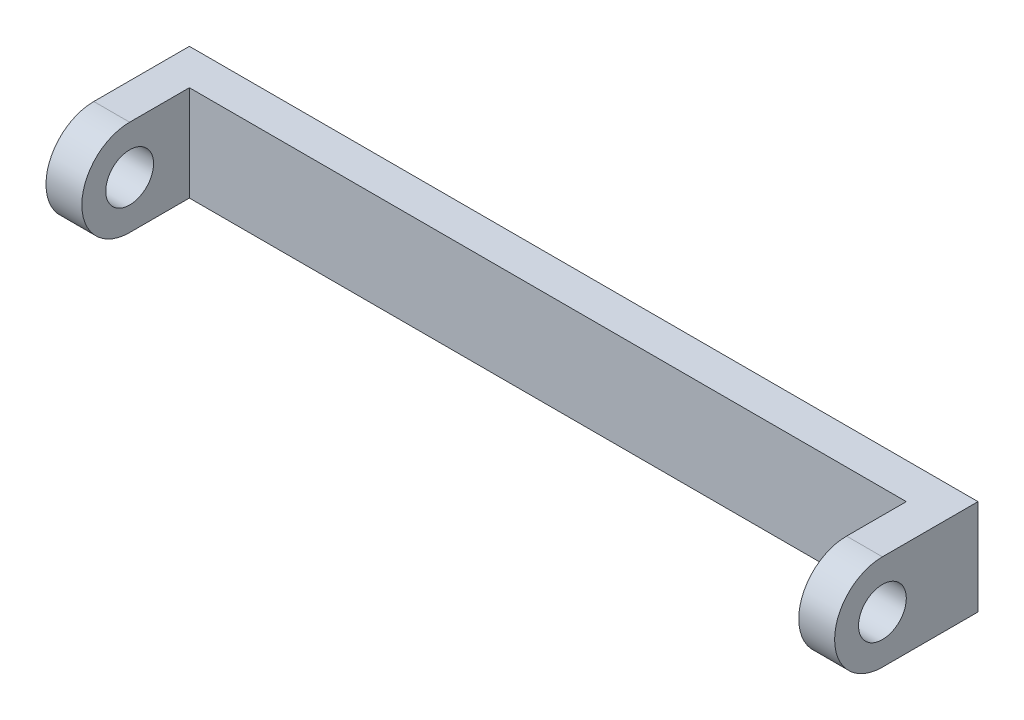
from build123d import *

# Parameters (mm, degrees)
SKETCH1_W                   = 3
SKETCH1_H                   = 8
SKETCH1_W_2                 = 30
BOSS_EXTRUDE3_DEPTH         = 3
SKETCH6_W                   = 3
SKETCH6_H                   = 8
BOSS_EXTRUDE5_DEPTH         = 9
FILLET3_RADIUS              = 4
FILLET3_LENGTH              = 3
SKETCH7_R                   = 2
CUT_EXTRUDE1_DEPTH          = 33.748571352
FILLET3_OF_MIRROR1_2_RADIUS = 4
FILLET3_OF_MIRROR1_2_LENGTH = 3


with BuildPart() as part:
    # Sketch1 → Boss-Extrude3 (new body)
    with BuildSketch(Plane.XY):
        with Locations((-35.895657312, 1.33562795)):
            Rectangle(SKETCH1_W, SKETCH1_H)
        with Locations((-19.395657312, 1.33562795)):
            Rectangle(SKETCH1_W_2, SKETCH1_H)
    boss_extrude3 = extrude(amount=BOSS_EXTRUDE3_DEPTH)

    # Sketch6 → Boss-Extrude5 (add)
    with BuildSketch(Plane.XY.offset(3)):
        with Locations((-35.895657312, 1.33562795)):
            Rectangle(SKETCH6_W, SKETCH6_H)
    boss_extrude5 = extrude(amount=BOSS_EXTRUDE5_DEPTH)

    # Fillet3: full round fillet: the end face becomes a half cylinder, R = half its width
    fillet3_face = Plane((-35.895657312, 1.33562795, 12), x_dir=(-1, 0, 0), z_dir=(0, 0, 1))  # on the end face: x along it, z out of the body
    fillet3_slab = fillet3_face.offset(-FILLET3_RADIUS / 2) * Box(FILLET3_LENGTH, 2 * FILLET3_RADIUS, FILLET3_RADIUS, mode=Mode.PRIVATE)  # the body's end, R deep
    fillet3_round = Plane((-35.895657312, 1.33562795, 8), x_dir=(0, 0, 1), z_dir=(-1, 0, 0)) * Cylinder(FILLET3_RADIUS, FILLET3_LENGTH, mode=Mode.PRIVATE)  # its axis R under the face
    add(fillet3_slab - fillet3_round, mode=Mode.SUBTRACT)

    # Sketch7 → Cut-Extrude1 (cut, through all)
    with BuildSketch(Plane(origin=(-34.395657312, 0, 0), x_dir=(0, 0, -1), z_dir=(1, 0, 0))):
        with Locations((-8, 1.33562795)):
            Circle(SKETCH7_R)
    cut_extrude1 = extrude(amount=-CUT_EXTRUDE1_DEPTH, mode=Mode.SUBTRACT)

    # Mirror1: Boss-Extrude3, Boss-Extrude5, Cut-Extrude1 across plane
    add(boss_extrude3.mirror(Plane(origin=(-4.395657312, 0, 0), x_dir=(0, 0, 1), z_dir=(1, 0, 0))))
    add(boss_extrude5.mirror(Plane(origin=(-4.395657312, 0, 0), x_dir=(0, 0, 1), z_dir=(1, 0, 0))))
    add(cut_extrude1.mirror(Plane(origin=(-4.395657312, 0, 0), x_dir=(0, 0, 1), z_dir=(1, 0, 0))), mode=Mode.SUBTRACT)

    # Fillet3 of Mirror1 2: full round fillet: the end face becomes a half cylinder, R = half its width
    fillet3_of_mirror1_2_face = Plane((27.104342688, 1.33562795, 12), x_dir=(1, 0, 0), z_dir=(0, 0, 1))  # on the end face: x along it, z out of the body
    fillet3_of_mirror1_2_slab = fillet3_of_mirror1_2_face.offset(-FILLET3_OF_MIRROR1_2_RADIUS / 2) * Box(FILLET3_OF_MIRROR1_2_LENGTH, 2 * FILLET3_OF_MIRROR1_2_RADIUS, FILLET3_OF_MIRROR1_2_RADIUS, mode=Mode.PRIVATE)  # the body's end, R deep
    fillet3_of_mirror1_2_round = Plane((27.104342688, 1.33562795, 8), x_dir=(0, 0, 1), z_dir=(1, 0, 0)) * Cylinder(FILLET3_OF_MIRROR1_2_RADIUS, FILLET3_OF_MIRROR1_2_LENGTH, mode=Mode.PRIVATE)  # its axis R under the face
    add(fillet3_of_mirror1_2_slab - fillet3_of_mirror1_2_round, mode=Mode.SUBTRACT)


solid = part.part
